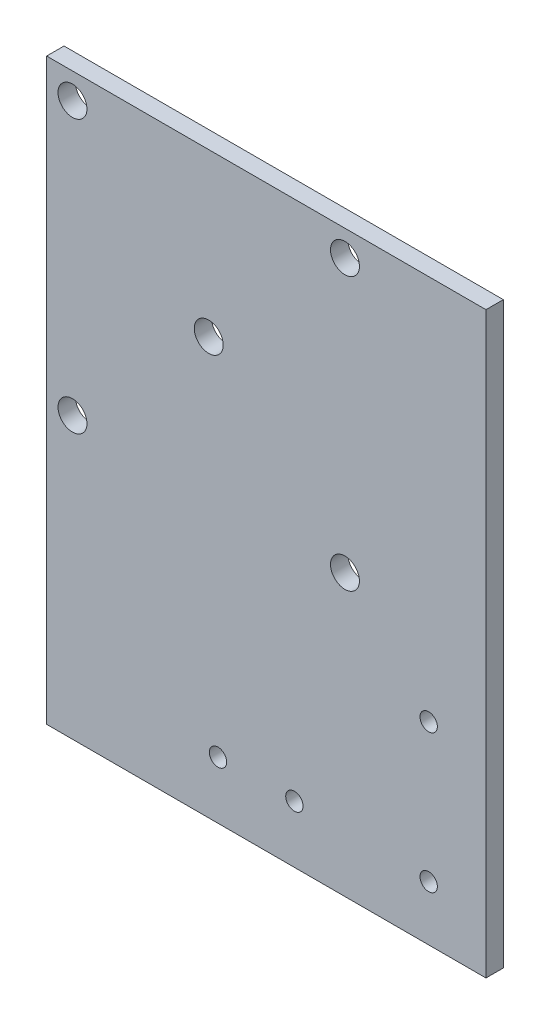
from build123d import *

# Parameters (mm, degrees)
SKETCH1_W           = 75.9
SKETCH1_H           = 100
BOSS_EXTRUDE1_DEPTH = 3
SKETCH2_R           = 2.5
CUT_EXTRUDE1_DEPTH  = 10
SKETCH5_R           = 1.5
CUT_EXTRUDE2_DEPTH  = 10
SKETCH7_R           = 1.5
CUT_EXTRUDE3_DEPTH  = 19.8
SKETCH8_R           = 2.5
CUT_EXTRUDE4_DEPTH  = 10


with BuildPart() as part:
    # Sketch1 → Boss-Extrude1 (new body)
    with BuildSketch(Plane.XY):
        with Locations((37.95, 50)):
            Rectangle(SKETCH1_W, SKETCH1_H)
    extrude(amount=BOSS_EXTRUDE1_DEPTH)

    # Sketch2 → Cut-Extrude1 (cut)
    with BuildSketch(Plane(origin=(0, 0, 0), x_dir=(-1, 0, 0), z_dir=(0, 0, -1))):
        with Locations((-51.538582233, 95.538582233)):
            Circle(SKETCH2_R)
        with Locations((-4.461417767, 95.538582233)):
            Circle(SKETCH2_R)
        with Locations((-4.461417767, 48.461417767)):
            Circle(SKETCH2_R)
        with Locations((-51.538582233, 48.461417767)):
            Circle(SKETCH2_R)
    extrude(amount=-CUT_EXTRUDE1_DEPTH, mode=Mode.SUBTRACT)

    # Sketch5 → Cut-Extrude2 (cut)
    with BuildSketch(Plane.XY.offset(3)):
        with Locations((66, 33.391370051)):
            Circle(SKETCH5_R)
        with Locations((66, 9.470993714)):
            Circle(SKETCH5_R)
    extrude(amount=-CUT_EXTRUDE2_DEPTH, mode=Mode.SUBTRACT)

    # Sketch7 → Cut-Extrude3 (cut)
    with BuildSketch(Plane(origin=(0, 0, 0), x_dir=(-1, 0, 0), z_dir=(0, 0, -1))):
        with Locations((-29.6, 9.9)):
            Circle(SKETCH7_R)
        with Locations((-42.8, 9.9)):
            Circle(SKETCH7_R)
    extrude(amount=-CUT_EXTRUDE3_DEPTH, mode=Mode.SUBTRACT)

    # Sketch8 → Cut-Extrude4 (cut)
    with BuildSketch(Plane(origin=(0, 0, 0), x_dir=(-1, 0, 0), z_dir=(0, 0, -1))):
        with Locations((-28, 72)):
            Circle(SKETCH8_R)
    extrude(amount=-CUT_EXTRUDE4_DEPTH, mode=Mode.SUBTRACT)


solid = part.part
